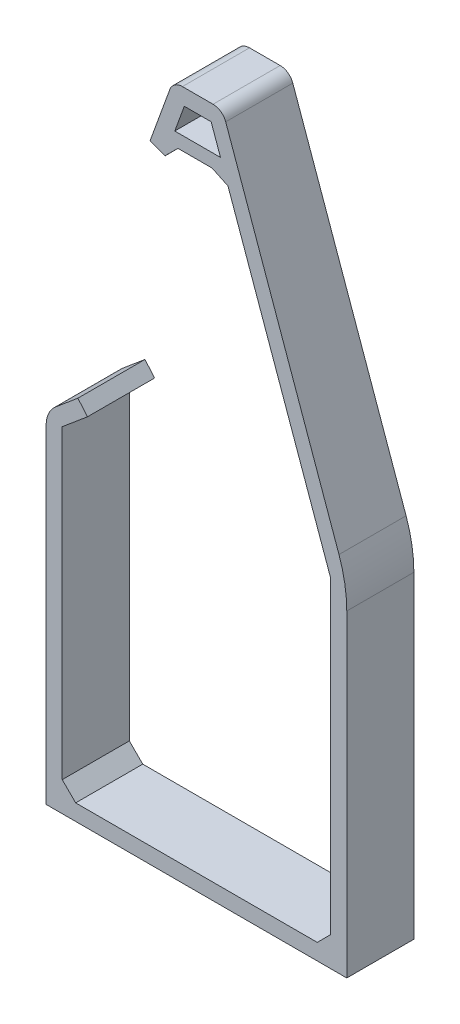
from build123d import *
from OCP.BRepFilletAPI import BRepFilletAPI_MakeChamfer

# Parameters (mm, degrees)
EXTRUDE_1_DEPTH     = 25
SKETCH_2_W          = 25
SKETCH_2_H          = 113.275398007
CUT_EXTRUDE_1_DEPTH = 10
EXTRUDE_1_2_DEPTH   = 25
FILLET_1_R          = 50
FILLET_2_R          = 5
CHAMFER_1_SIZE      = 3
CHAMFER_1_SIZE2     = 5.018091596
CHAMFER_1_SIZE2_2   = 4.946391741
EXTRUDE_2_DEPTH     = 25
FILLET_3_R          = 10
CHAMFER_2_SIZE      = 5


with BuildPart() as part:
    # 草图1 → Extrude 1 (new body)
    with BuildSketch(Plane.XY):
        Polygon((-40.289701428, 251), (6, 121.036629463), (6, -6), (-106, -6), (-106, 121.057565217), (-58.723691593, 251), align=None)
        Polygon((-44.521873006, 245), (0, 120), (0, 0), (-100, 0), (-100, 120), (-54.521873006, 245), align=None, mode=Mode.SUBTRACT)
    extrude(amount=EXTRUDE_1_DEPTH)

    # 草图2 → 切除-拉伸1 (cut)
    with BuildSketch(Plane(origin=(-132.504349732, 48.208397155, 0), x_dir=(0, 0, 1), z_dir=(-0.9397364726914574, 0.34189963716479416, 0))):
        with Locations((12.5, 134.158546794)):
            Rectangle(SKETCH_2_W, SKETCH_2_H)
    extrude(amount=-CUT_EXTRUDE_1_DEPTH, mode=Mode.SUBTRACT)

    # 草图4 → Extrude 1 2 (add)
    with BuildSketch(Plane.XY.offset(25)):
        Polygon((-58.077318346, 235.22759518), (-41.041186875, 235.22759518), (-39.260311955, 230.22759518), (-59.896443426, 230.22759518), align=None)
    extrude(amount=-EXTRUDE_1_2_DEPTH)

    # 圆角1
    fillet_1_edges = [part.edges().sort_by_distance(p)[0] for p in [
        (6, 121.036629463, 12.5),
    ]]
    fillet(fillet_1_edges, radius=FILLET_1_R)

    # 圆角2
    fillet_2_edges = [part.edges().sort_by_distance(p)[0] for p in [
        (-58.723691593, 251, 12.5),
        (-40.289701428, 251, 12.5),
    ]]
    fillet(fillet_2_edges, radius=FILLET_2_R)

    # 倒角1: one chamfer whose edges measure the first distance from different faces: ONE call of the kernel's chamfer builder (chamfer() names one face for all edges)
    chamfer_1_edges_1 = [part.edges().sort_by_distance(p)[0] for p in [
        (-59.896443426, 230.22759518, 12.5),
    ]]
    chamfer_1_side_1 = [part.faces().sort_by_distance(p)[0] for p in [
        (-49.57837769, 230.22759518, 12.5),
    ]]
    chamfer_1_edges_2 = [part.edges().sort_by_distance(p)[0] for p in [
        (-39.260311955, 230.22759518, 12.5),
    ]]
    chamfer_1_side_2 = [part.faces().sort_by_distance(p)[0] for p in [
        (-19.630155978, 175.11379759, 12.5),
    ]]
    chamfer_1 = BRepFilletAPI_MakeChamfer(part.part.solid().wrapped)
    for e in chamfer_1_edges_1:
        chamfer_1.Add(CHAMFER_1_SIZE, CHAMFER_1_SIZE2, e.wrapped, chamfer_1_side_1[0].wrapped)  # the first distance lies on this face
    for e in chamfer_1_edges_2:
        chamfer_1.Add(CHAMFER_1_SIZE, CHAMFER_1_SIZE2_2, e.wrapped, chamfer_1_side_2[0].wrapped)  # the first distance lies on this face
    add(Compound.cast(chamfer_1.Shape()), mode=Mode.REPLACE)

    # 草图5 → 凸台-拉伸2 (add)
    with BuildSketch(Plane.XY.offset(25)):
        Polygon((-106, 121.057565217), (-94.163375331, 130.992259513), (-90.60862045, 126.756970729), (-100, 118.874615121), align=None)
    extrude(amount=-EXTRUDE_2_DEPTH)

    # 圆角3
    fillet_3_edges = [part.edges().sort_by_distance(p)[0] for p in [
        (-106, 121.057565217, 12.5),
    ]]
    fillet(fillet_3_edges, radius=FILLET_3_R)

    # 倒角2
    chamfer_2_edges = [part.edges().sort_by_distance(p)[0] for p in [
        (0, 0, 12.5),
        (-100, 0, 12.5),
    ]]
    chamfer(chamfer_2_edges, length=CHAMFER_2_SIZE)


solid = part.part
